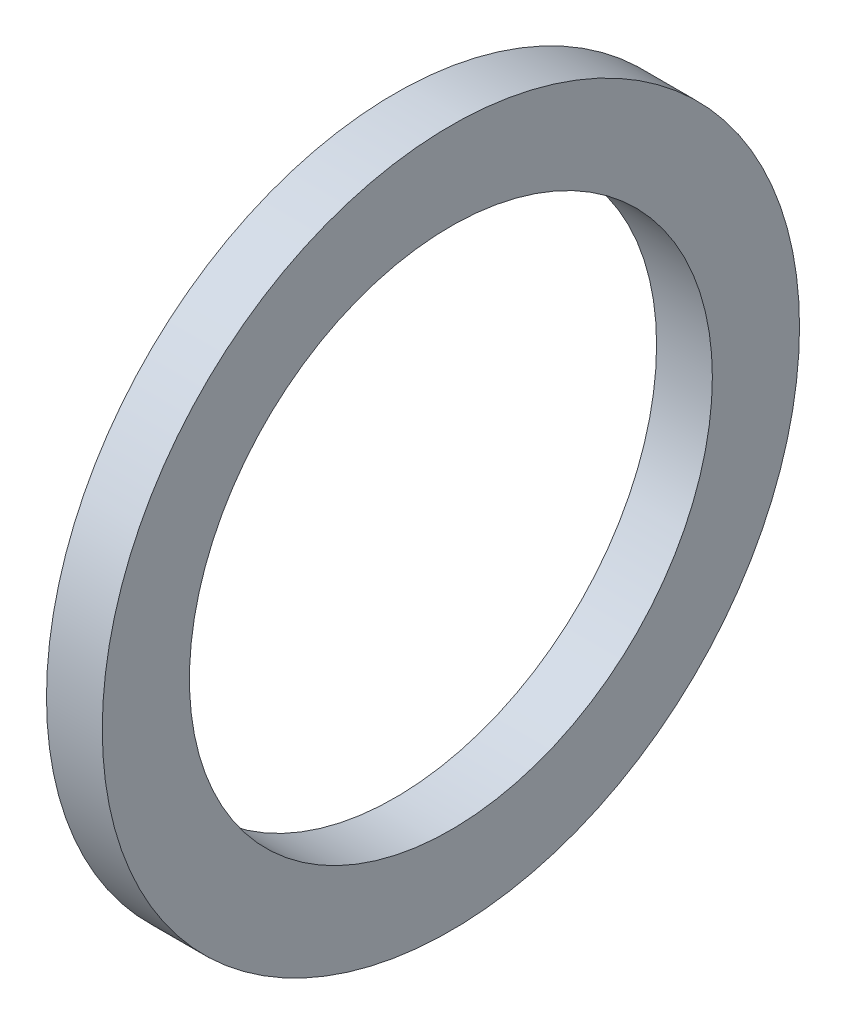
from build123d import *

# Parameters (mm, degrees)
SKETCH1_R           = 3.175
SKETCH1_R_2         = 2.38125
BOSS_EXTRUDE1_DEPTH = 0.508


with BuildPart() as part:
    # Sketch1 → Boss-Extrude1 (new body)
    with BuildSketch(Plane(origin=(0, 0, 0), x_dir=(0, 0, -1), z_dir=(1, 0, 0))):
        Circle(SKETCH1_R)
        Circle(SKETCH1_R_2, mode=Mode.SUBTRACT)
    extrude(amount=BOSS_EXTRUDE1_DEPTH)


solid = part.part
